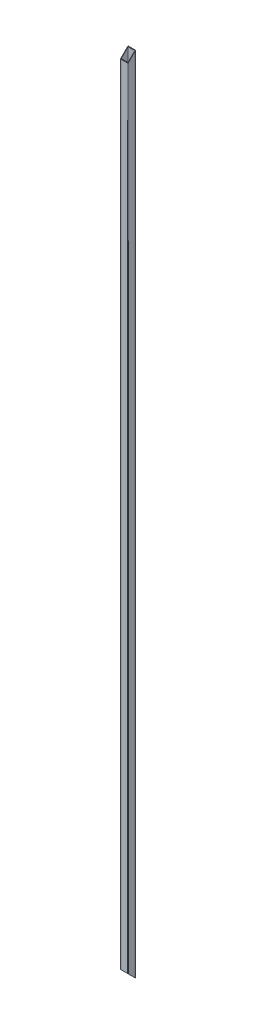
from build123d import *

# Parameters (mm, degrees)
EXTRUDE_1_DEPTH     = 4240
CUT_EXTRUDE_1_DEPTH = 4241.235842497


with BuildPart() as part:
    # Эскиз2 → Бобышка-Вытянуть1 (new body)
    with BuildSketch(Plane(origin=(0, 0, 0), x_dir=(1, 0, 0), z_dir=(0, 1, 0))):
        with BuildLine():
            Line((-18, 20), (18, 20))
            ThreePointArc((18, 20), (19.414213562, 19.414213562), (20, 18))
            Line((20, 18), (20, -18))
            ThreePointArc((20, -18), (19.414213562, -19.414213562), (18, -20))
            Line((18, -20), (-18, -20))
            ThreePointArc((-18, -20), (-19.414213562, -19.414213562), (-20, -18))
            Line((-20, -18), (-20, 18))
            ThreePointArc((-20, 18), (-19.414213562, 19.414213562), (-18, 20))
        make_face()
        with BuildLine():
            Line((16, -18), (-16, -18))
            ThreePointArc((-16, -18), (-17.414213562, -17.414213562), (-18, -16))
            Line((-18, -16), (-18, 16))
            ThreePointArc((-18, 16), (-17.414213562, 17.414213562), (-16, 18))
            Line((-16, 18), (16, 18))
            ThreePointArc((16, 18), (17.414213562, 17.414213562), (18, 16))
            Line((18, 16), (18, -16))
            ThreePointArc((18, -16), (17.414213562, -17.414213562), (16, -18))
        make_face(mode=Mode.SUBTRACT)
    extrude(amount=EXTRUDE_1_DEPTH)

    # Эскиз3 → Вырез-Вытянуть1 (cut, through all)
    with BuildSketch(Plane(origin=(20, 0, 0), x_dir=(0, 0, -1), z_dir=(1, 0, 0))):
        Polygon((20, 4240), (-20, 4240), (-20, 4200), align=None)
        Polygon((20, 0), (-20, 0), (-20, 40), align=None)
    extrude(amount=-CUT_EXTRUDE_1_DEPTH, mode=Mode.SUBTRACT)


solid = part.part
